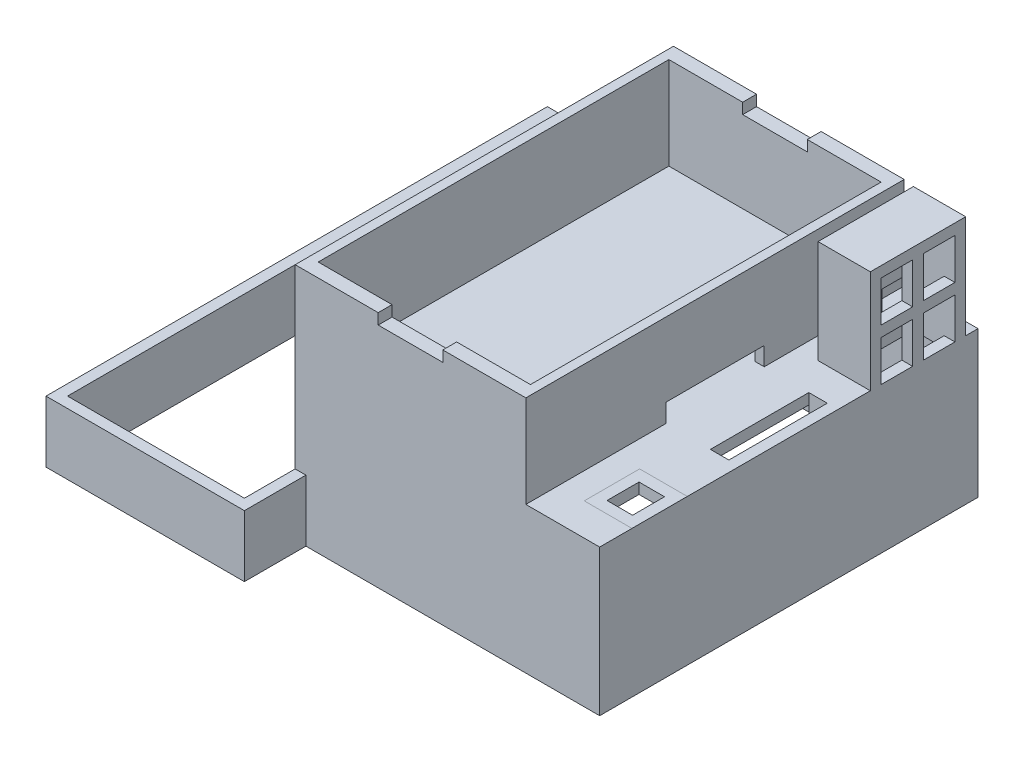
from build123d import *

# Parameters (mm, degrees)
SKETCH1_W               = 49.5
SKETCH1_H               = 61.5
BOSS_EXTRUDE1_DEPTH     = 23.75
SKETCH2_W               = 46
SKETCH2_H               = 58
CUT_EXTRUDE1_DEPTH      = 22
SKETCH3_W               = 3
SKETCH3_H               = 16
CUT_EXTRUDE2_DEPTH      = 1.75
SKETCH7_W               = 3
SKETCH7_H               = 5
BOSS_EXTRUDE2_DEPTH     = 6
SKETCH11_W              = 37.5
SKETCH11_H              = 61.5
BOSS_EXTRUDE3_DEPTH     = 15
SKETCH12_W              = 34.5
SKETCH12_H              = 57
CUT_EXTRUDE3_DEPTH      = 15
SKETCH14_W              = 7.75
SKETCH14_H              = 9
BOSS_EXTRUDE4_DEPTH     = 0.0001
SKETCH15_W              = 4.15
SKETCH15_H              = 5.2
CUT_EXTRUDE4_DEPTH      = 4.75
SKETCH16_W              = 8.5
SKETCH16_H              = 15.5
BOSS_EXTRUDE5_DEPTH     = 16.75
SKETCH17_W              = 5.125
SKETCH17_H              = 6.625
CUT_EXTRUDE5_DEPTH      = 8.5
CUT_EXTRUDE6_DEPTH      = 15
CUT_EXTRUDE6_DEPTH_BACK = 1.75
SKETCH18_W              = 5
SKETCH18_H              = 12
SKETCH20_W              = 16
SKETCH20_H              = 3
CUT_EXTRUDE7_DEPTH      = 1.75
SKETCH21_W              = 32.25
SKETCH21_H              = 81.5
BOSS_EXTRUDE7_DEPTH     = 10
SKETCH23_W              = 28.75
SKETCH23_H              = 78
CUT_EXTRUDE8_DEPTH      = 10
SKETCH25_W              = 3
SKETCH25_H              = 5.4
BOSS_EXTRUDE8_DEPTH     = 1.75
SKETCH28_W              = 3
SKETCH28_H              = 2
BOSS_EXTRUDE9_DEPTH     = 1.75
SKETCH30_W              = 5
SKETCH30_H              = 1.5
BOSS_EXTRUDE11_DEPTH    = 1
SKETCH32_W              = 10.5
SKETCH32_H              = 2.25
CUT_EXTRUDE9_DEPTH      = 1.75
SKETCH33_W              = 11
SKETCH33_H              = 11
CUT_EXTRUDE10_DEPTH     = 1
BOSS_EXTRUDE12_DEPTH    = 2


with BuildPart() as part:
    # Sketch1 → Boss-Extrude1 (new body)
    with BuildSketch(Plane(origin=(0, 0, 0), x_dir=(1, 0, 0), z_dir=(0, 1, 0))):
        with Locations((-113.412024913, -45.391200727)):
            Rectangle(SKETCH1_W, SKETCH1_H)
    extrude(amount=BOSS_EXTRUDE1_DEPTH)

    # Sketch2 → Cut-Extrude1 (cut)
    with BuildSketch(Plane(origin=(0, 0, 0), x_dir=(-1, 0, 0), z_dir=(0, -1, 0))):
        with Locations((113.412024913, -45.391200727)):
            Rectangle(SKETCH2_W, SKETCH2_H)
    extrude(amount=-CUT_EXTRUDE1_DEPTH, mode=Mode.SUBTRACT)

    # Sketch3 → Cut-Extrude2 (cut)
    with BuildSketch(Plane(origin=(0, 22, 0), x_dir=(-1, 0, 0), z_dir=(0, -1, 0))):
        with Locations((91.912024913, -66.391200727)):
            Rectangle(SKETCH3_W, SKETCH3_H)
        with Locations((91.912024913, -45.391200727)):
            Rectangle(SKETCH3_W, SKETCH3_H)
        with Locations((91.912024913, -24.391200727)):
            Rectangle(SKETCH3_W, SKETCH3_H)
    extrude(amount=-CUT_EXTRUDE2_DEPTH, mode=Mode.SUBTRACT)

    # Sketch7 → Boss-Extrude2 (add)
    with BuildSketch(Plane(origin=(0, 22, 0), x_dir=(-1, 0, 0), z_dir=(0, -1, 0))):
        with Locations((91.912024913, -55.891200727)):
            Rectangle(SKETCH7_W, SKETCH7_H)
        with Locations((91.912024913, -34.891200727)):
            Rectangle(SKETCH7_W, SKETCH7_H)
    extrude(amount=BOSS_EXTRUDE2_DEPTH)

    # Sketch11 → Boss-Extrude3 (add)
    with BuildSketch(Plane(origin=(0, 23.75, 0), x_dir=(1, 0, 0), z_dir=(0, 1, 0))):
        with Locations((-119.412024913, -45.391200727)):
            Rectangle(SKETCH11_W, SKETCH11_H)
    extrude(amount=BOSS_EXTRUDE3_DEPTH)

    # Sketch12 → Cut-Extrude3 (cut)
    with BuildSketch(Plane(origin=(0, 38.75, 0), x_dir=(1, 0, 0), z_dir=(0, 1, 0))):
        with Locations((-119.412024913, -45.391200727)):
            Rectangle(SKETCH12_W, SKETCH12_H)
    extrude(amount=-CUT_EXTRUDE3_DEPTH, mode=Mode.SUBTRACT)

    # Sketch14 → Boss-Extrude4 (add)
    with BuildSketch(Plane(origin=(0, 23.75, 0), x_dir=(1, 0, 0), z_dir=(0, 1, 0))):
        with Locations((-92.542024913, -66.391200727)):
            Rectangle(SKETCH14_W, SKETCH14_H)
    extrude(amount=BOSS_EXTRUDE4_DEPTH)

    # Sketch15 → Cut-Extrude4 (cut)
    with BuildSketch(Plane(origin=(0, 23.7501, 0), x_dir=(1, 0, 0), z_dir=(0, 1, 0))):
        with Locations((-92.542024913, -66.391200727)):
            Rectangle(SKETCH15_W, SKETCH15_H)
    extrude(amount=-CUT_EXTRUDE4_DEPTH, mode=Mode.SUBTRACT)

    # Sketch16 → Boss-Extrude5 (add)
    with BuildSketch(Plane(origin=(0, 23.75, 0), x_dir=(1, 0, 0), z_dir=(0, 1, 0))):
        with Locations((-92.912024913, -24.391200727)):
            Rectangle(SKETCH16_W, SKETCH16_H)
    extrude(amount=BOSS_EXTRUDE5_DEPTH)

    # Sketch17 → Cut-Extrude5 (cut)
    with BuildSketch(Plane(origin=(-88.662024913, 0, 0), x_dir=(0, 0, -1), z_dir=(1, 0, 0))):
        with Locations((-27.828700727, 35.4375)):
            Rectangle(SKETCH17_W, SKETCH17_H)
        with Locations((-27.828700727, 27.0625)):
            Rectangle(SKETCH17_W, SKETCH17_H)
        with Locations((-20.953700727, 35.4375)):
            Rectangle(SKETCH17_W, SKETCH17_H)
        with Locations((-20.953700727, 27.0625)):
            Rectangle(SKETCH17_W, SKETCH17_H)
    extrude(amount=-CUT_EXTRUDE5_DEPTH, mode=Mode.SUBTRACT)

    # Sketch18 → Cut-Extrude6 (cut, two sides: drawn at the far end of the back side and taken through both)
    with BuildSketch(Plane(origin=(0, 23.75, 0), x_dir=(1, 0, 0), z_dir=(0, 1, 0)).offset(-CUT_EXTRUDE6_DEPTH_BACK)):
        with Locations((-92.912024913, -24.391200727)):
            Rectangle(SKETCH18_W, SKETCH18_H)
    extrude(amount=CUT_EXTRUDE6_DEPTH + CUT_EXTRUDE6_DEPTH_BACK, mode=Mode.SUBTRACT)

    # Sketch20 → Cut-Extrude7 (cut)
    with BuildSketch(Plane(origin=(-100.662024913, 0, 0), x_dir=(0, 0, -1), z_dir=(1, 0, 0))):
        with Locations((-45.391200727, 25.25)):
            Rectangle(SKETCH20_W, SKETCH20_H)
    extrude(amount=-CUT_EXTRUDE7_DEPTH, mode=Mode.SUBTRACT)

    # Sketch21 → Boss-Extrude7 (add)
    with BuildSketch(Plane(origin=(0, 0, 0), x_dir=(-1, 0, 0), z_dir=(0, -1, 0))):
        with Locations((152.537024913, -45.391200727)):
            Rectangle(SKETCH21_W, SKETCH21_H)
    extrude(amount=-BOSS_EXTRUDE7_DEPTH)

    # Sketch23 → Cut-Extrude8 (cut)
    with BuildSketch(Plane(origin=(0, 10, 0), x_dir=(1, 0, 0), z_dir=(0, 1, 0))):
        with Locations((-152.537024913, -45.391200727)):
            Rectangle(SKETCH23_W, SKETCH23_H)
    extrude(amount=-CUT_EXTRUDE8_DEPTH, mode=Mode.SUBTRACT)

    # Sketch25 → Boss-Extrude8 (add)
    with BuildSketch(Plane(origin=(0, 22, 0), x_dir=(-1, 0, 0), z_dir=(0, -1, 0))):
        with Locations((91.912024913, -61.091200727)):
            Rectangle(SKETCH25_W, SKETCH25_H)
        with Locations((91.912024913, -71.691200727)):
            Rectangle(SKETCH25_W, SKETCH25_H)
    extrude(amount=-BOSS_EXTRUDE8_DEPTH)

    # Sketch28 → Boss-Extrude9 (add)
    with BuildSketch(Plane(origin=(0, 23.75, 0), x_dir=(1, 0, 0), z_dir=(0, 1, 0))):
        with Locations((-91.912024913, -17.391200727)):
            Rectangle(SKETCH28_W, SKETCH28_H)
        with Locations((-91.912024913, -31.391200727)):
            Rectangle(SKETCH28_W, SKETCH28_H)
    extrude(amount=-BOSS_EXTRUDE9_DEPTH)

    # Sketch30 → Boss-Extrude11 (add)
    with BuildSketch(Plane.ZY.offset(93.412024913)):
        with Locations((55.891200727, 16.75)):
            Rectangle(SKETCH30_W, SKETCH30_H)
        with Locations((34.891200727, 16.75)):
            Rectangle(SKETCH30_W, SKETCH30_H)
    extrude(amount=BOSS_EXTRUDE11_DEPTH)

    # Sketch32 → Cut-Extrude9 (cut)
    with BuildSketch(Plane(origin=(0, 38.75, 0), x_dir=(1, 0, 0), z_dir=(0, 1, 0))):
        with Locations((-119.412024913, -75.016200727)):
            Rectangle(SKETCH32_W, SKETCH32_H)
        with Locations((-119.412024913, -15.766200727)):
            Rectangle(SKETCH32_W, SKETCH32_H)
    extrude(amount=-CUT_EXTRUDE9_DEPTH, mode=Mode.SUBTRACT)

    # Sketch33 → Cut-Extrude10 (cut)
    with BuildSketch(Plane.ZY.offset(90.412024913)):
        with Locations((32.891200727, 5.5)):
            Rectangle(SKETCH33_W, SKETCH33_H)
    extrude(amount=-CUT_EXTRUDE10_DEPTH, mode=Mode.SUBTRACT)

    # Sketch34 → Boss-Extrude12 (add)
    with BuildSketch(Plane.ZY.offset(90.412024913)):
        Polygon((26.391200727, 0), (27.391200727, 0), (27.391200727, 11), (38.391200727, 11), (38.391200727, 0), (39.391200727, 0), (39.391200727, 12), (26.391200727, 12), align=None)
    extrude(amount=BOSS_EXTRUDE12_DEPTH)


solid = part.part
